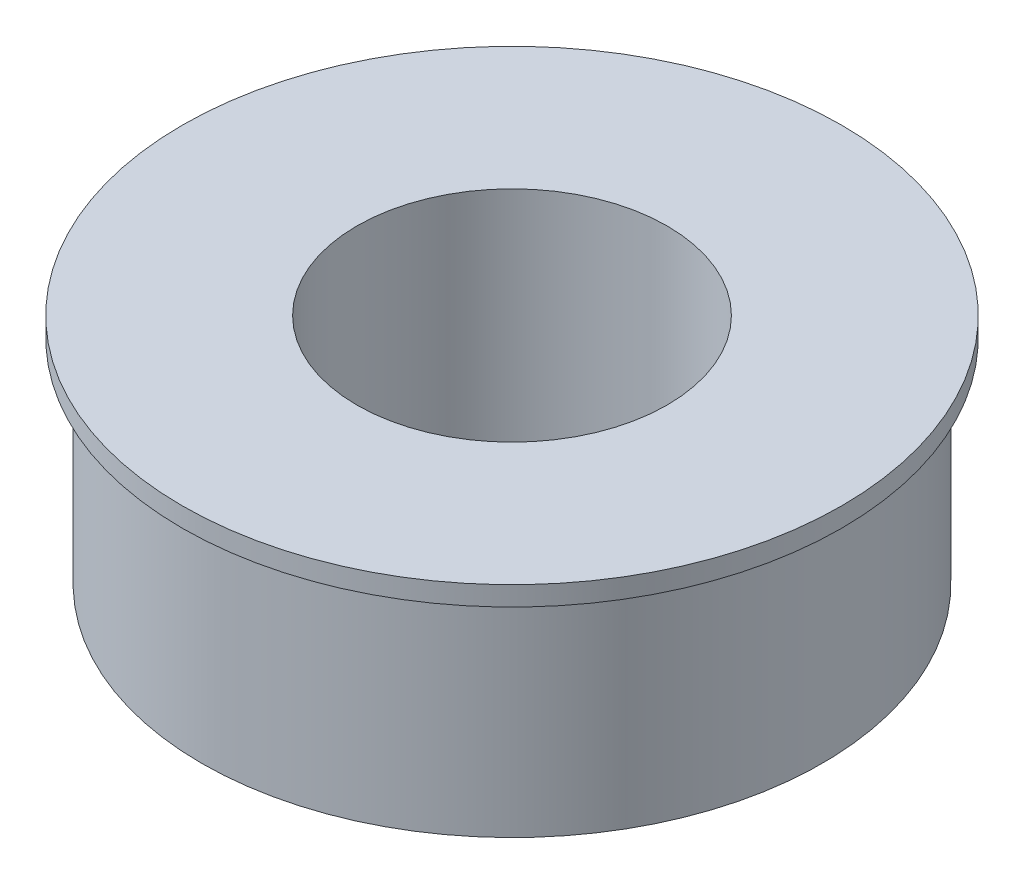
from build123d import *

# Parameters (mm, degrees)
SKETCH1_R           = 25.4
SKETCH1_R_2         = 12.7
BOSS_EXTRUDE1_DEPTH = 17.4625
SKETCH2_R           = 26.9875
SKETCH2_R_2         = 12.7
BOSS_EXTRUDE2_DEPTH = 1.5875


with BuildPart() as part:
    # Sketch1 → Boss-Extrude1 (new body)
    with BuildSketch(Plane(origin=(0, 0, 0), x_dir=(1, 0, 0), z_dir=(0, 1, 0))):
        with Locations(Location((0, 0, 0), (0, 0, 270))):
            Circle(SKETCH1_R)
        with Locations(Location((0, 0, 0), (0, 0, 270))):
            Circle(SKETCH1_R_2, mode=Mode.SUBTRACT)
    extrude(amount=BOSS_EXTRUDE1_DEPTH)

    # Sketch2 → Boss-Extrude2 (add)
    with BuildSketch(Plane(origin=(0, 17.4625, 0), x_dir=(1, 0, 0), z_dir=(0, 1, 0))):
        with Locations(Location((0, 0, 0), (0, 0, 270))):
            Circle(SKETCH2_R)
        with Locations(Location((0, 0, 0), (0, 0, 270))):
            Circle(SKETCH2_R_2, mode=Mode.SUBTRACT)
    extrude(amount=BOSS_EXTRUDE2_DEPTH)


solid = part.part
